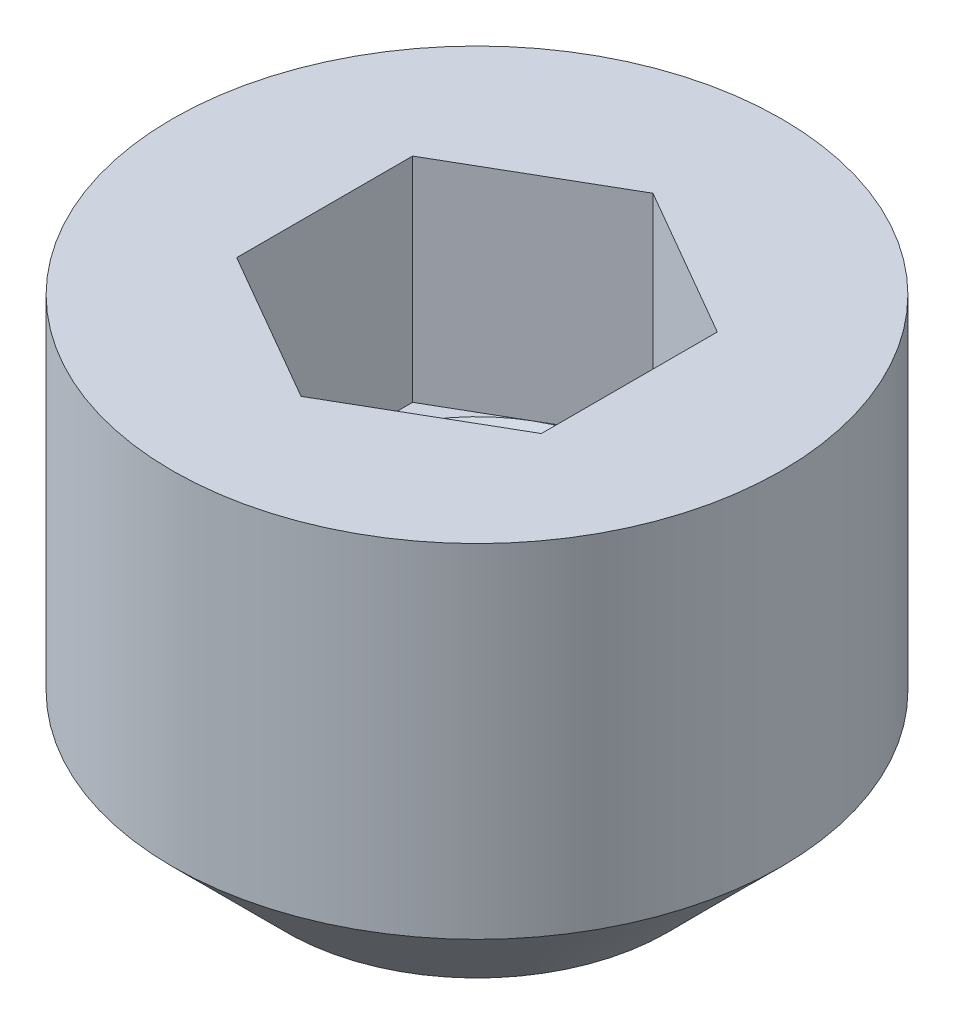
from build123d import *

# Parameters (mm, degrees)
SKETCH1_W          = 2
SKETCH1_H          = 3
CUT_EXTRUDE1_DEPTH = 1.4


with BuildPart() as part:
    # Sketch1 → Revolve1 (revolve)
    with BuildSketch(Plane.XY, mode=Mode.PRIVATE) as revolve1_sk:
        with Locations((1, 1.5)):
            Rectangle(SKETCH1_W, SKETCH1_H)
    revolve(revolve1_sk.sketch.rotate(Axis((0, 3, 0), (0, -1, 0)), 180), axis=Axis((0, 3, 0), (0, -1, 0)))

    # Sketch2 → Cut-Revolve1 (revolve, cut)
    with BuildSketch(Plane.XY, mode=Mode.PRIVATE) as cut_revolve1_sk:
        Polygon((0, 3), (1, 3), (1, 1.6), (0, 1.022649731), align=None)
    revolve(cut_revolve1_sk.sketch.rotate(Axis((0, 3, 0), (0, -1, 0)), 180), axis=Axis((0, 3, 0), (0, -1, 0)), mode=Mode.SUBTRACT)

    # Sketch3 → Cut-Extrude1 (cut)
    with BuildSketch(Plane(origin=(0, 3, 0), x_dir=(1, 0, 0), z_dir=(0, 1, 0))):
        Polygon((0, 1.154700538), (-1, 0.577350269), (-1, -0.577350269), (0, -1.154700538), (1, -0.577350269), (1, 0.577350269), align=None)
    extrude(amount=-CUT_EXTRUDE1_DEPTH, mode=Mode.SUBTRACT)

    # Sketch4 → Cut-Revolve2 (revolve, cut)
    with BuildSketch(Plane.XY, mode=Mode.PRIVATE) as cut_revolve2_sk:
        Polygon((2, 0.75), (2, 0), (1.25, 0), align=None)
    revolve(cut_revolve2_sk.sketch.rotate(Axis((0, 3, 0), (0, -1, 0)), 180), axis=Axis((0, 3, 0), (0, -1, 0)), mode=Mode.SUBTRACT)


solid = part.part
